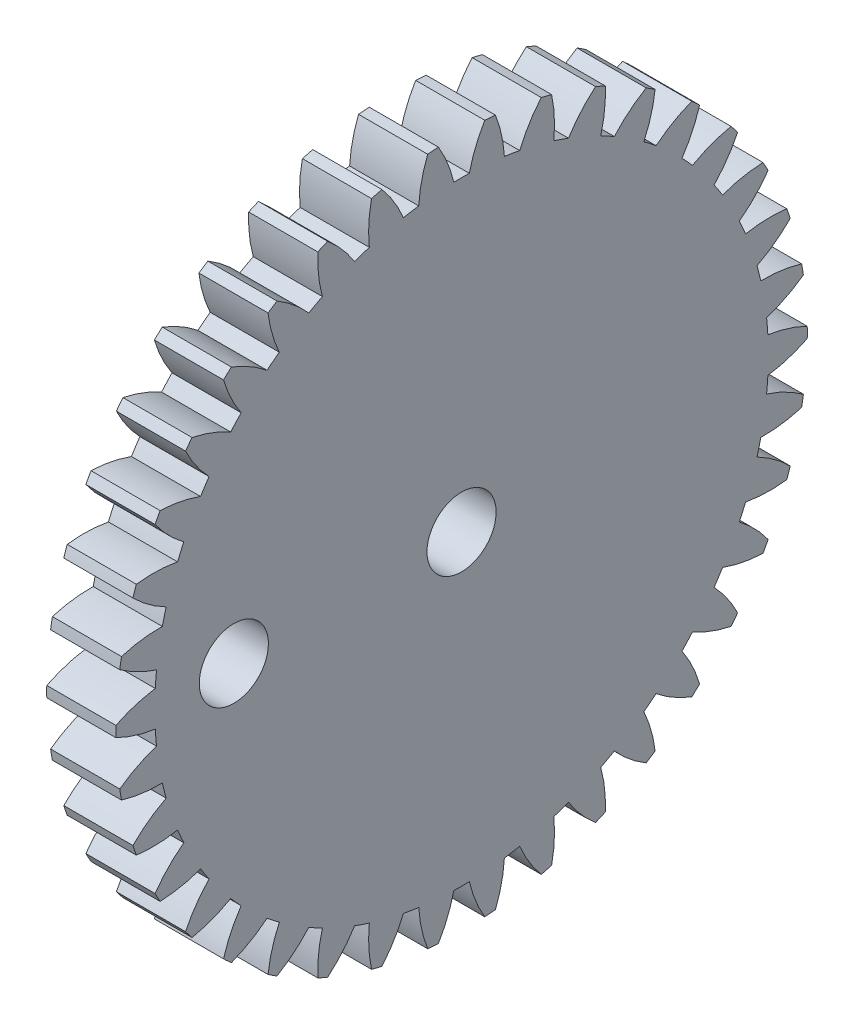
from build123d import *

# Parameters (mm, degrees)
BASPROSKE_W        = 6.35
BASPROSKE_H        = 31.75
TOOTHCUT_DEPTH     = 46.348070521
TEETHCUTS_COUNT    = 38
TEETHCUTS_ANGLE    = 350.526315789
BORSKE_R           = 3.175
BORE_DEPTH         = 50.8000508
SKETCH1_R          = 3.175
CUT_EXTRUDE1_DEPTH = 6.35


with BuildPart() as part:
    # BasProSke → Base-Revolve (revolve)
    with BuildSketch(Plane(origin=(0, 0, 0), x_dir=(1, 0, 0), z_dir=(0, 1, 0)), mode=Mode.PRIVATE) as base_revolve_sk:
        with Locations((3.175, 15.875)):
            Rectangle(BASPROSKE_W, BASPROSKE_H)
    revolve(base_revolve_sk.sketch.rotate(Axis((-10, 0, 0), (1, 0, 0)), 180), axis=Axis((-10, 0, 0), (1, 0, 0)))

    # TooCutSke → ToothCut (cut, through all)
    with BuildSketch(Plane(origin=(0, 0, 0), x_dir=(0, 0, -1), z_dir=(1, 0, 0))):
        with BuildLine():
            ThreePointArc((0.711671727, 28.167866107), (0, 28.176855), (-0.711671727, 28.167866107))
            ThreePointArc((-0.711671727, 28.167866107), (-1.288594949, 29.992415834), (-2.146735859, 31.70280067))
            ThreePointArc((-2.146735859, 31.70280067), (0, 31.7754), (2.146735859, 31.70280067))
            ThreePointArc((2.146735859, 31.70280067), (1.288594949, 29.992415834), (0.711671727, 28.167866107))
        make_face()
    toothcut = extrude(amount=TOOTHCUT_DEPTH, mode=Mode.SUBTRACT)

    # TeethCuts: ToothCut ×38 about axis
    teethcuts_axis = Axis((-10, 0, 0), (1, 0, 0))
    for i in range(1, TEETHCUTS_COUNT):
        add(toothcut.rotate(teethcuts_axis, i * TEETHCUTS_ANGLE / (TEETHCUTS_COUNT - 1)), mode=Mode.SUBTRACT)

    # BorSke → Bore (cut, symmetric)
    with BuildSketch(Plane(origin=(0, 0, 0), x_dir=(0, 0, -1), z_dir=(1, 0, 0))):
        with Locations(Location((0, 0, 0), (0, 0, 180))):
            Circle(BORSKE_R)
    extrude(amount=BORE_DEPTH, both=True, mode=Mode.SUBTRACT)

    # Sketch1 → Cut-Extrude1 (cut)
    with BuildSketch(Plane(origin=(6.35, 0, 0), x_dir=(0, 0, -1), z_dir=(1, 0, 0))):
        with Locations((-20.914000001, -4e-09)):
            Circle(SKETCH1_R)
    extrude(amount=-CUT_EXTRUDE1_DEPTH, mode=Mode.SUBTRACT)


solid = part.part
